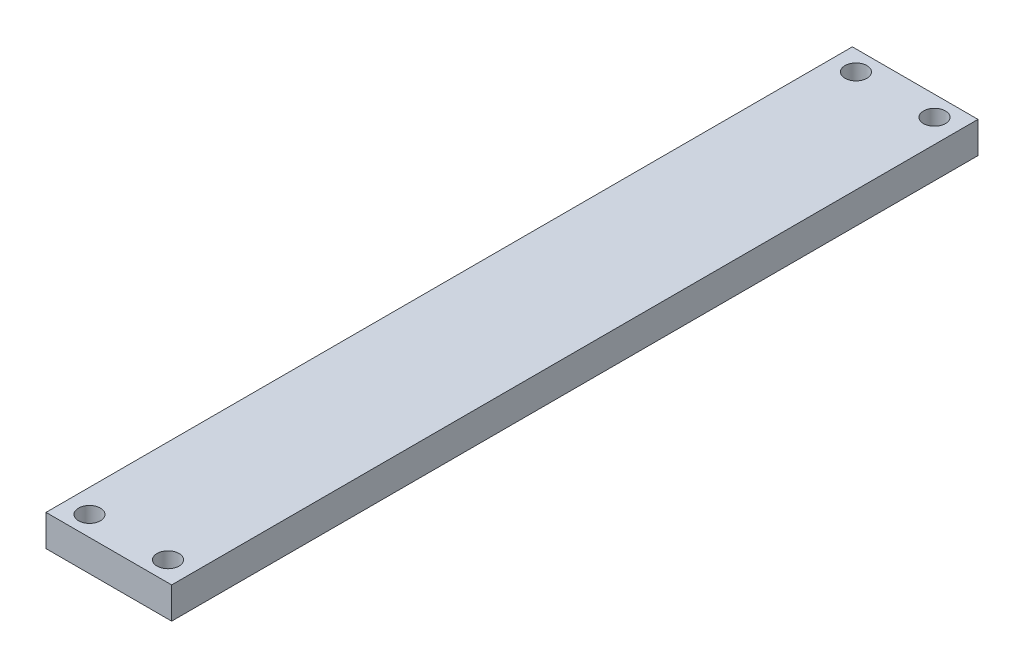
from build123d import *

# Parameters (mm, degrees)
SKETCH1_W           = 20
SKETCH1_H           = 5
BOSS_EXTRUDE1_DEPTH = 64.175
SKETCH2_R           = 1.75
CUT_EXTRUDE1_DEPTH  = 66.14161976


with BuildPart() as part:
    # Sketch1 → Boss-Extrude1 (new, symmetric)
    with BuildSketch(Plane.XY):
        Rectangle(SKETCH1_W, SKETCH1_H)
    extrude(amount=BOSS_EXTRUDE1_DEPTH, both=True)

    # Sketch2 → Cut-Extrude1 (cut, through all)
    with BuildSketch(Plane(origin=(0, 2.5, 0), x_dir=(1, 0, 0), z_dir=(0, 1, 0))):
        with Locations(Location((-6.25, -61, 0), (0, 0, 270))):
            Circle(SKETCH2_R)
        with Locations(Location((6.25, -61, 0), (0, 0, 90))):
            Circle(SKETCH2_R)
        with Locations(Location((6.25, 61, 0), (0, 0, 270))):
            Circle(SKETCH2_R)
        with Locations(Location((-6.25, 61, 0), (0, 0, 90))):
            Circle(SKETCH2_R)
    extrude(amount=-CUT_EXTRUDE1_DEPTH, mode=Mode.SUBTRACT)


solid = part.part
